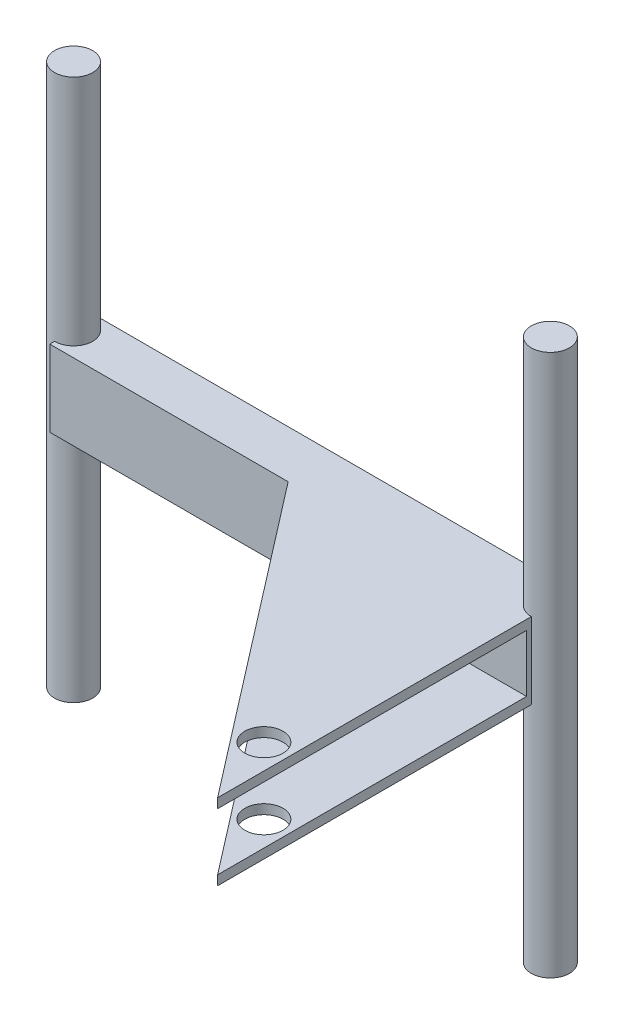
from build123d import *

# Parameters (mm, degrees)
SKETCH1_W                = 500
SKETCH1_H                = 80
BOSS_EXTRUDE1_DEPTH      = 50
BOSS_EXTRUDE2_DEPTH      = 244.1
BOSS_EXTRUDE2_DEPTH_BACK = 324.1
SKETCH2_R                = 20
BOSS_EXTRUDE5_DEPTH      = 10
BOSS_EXTRUDE6_DEPTH      = 10
CUT_EXTRUDE4_DEPTH       = 613.808106347
CUT_EXTRUDE4_DEPTH_BACK  = 613.808106347
SKETCH7_R                = 20


with BuildPart() as part:
    # Sketch1 → Boss-Extrude1 (new body)
    with BuildSketch(Plane.XY):
        with Locations((91.40969163, 3.77753304)):
            Rectangle(SKETCH1_W, SKETCH1_H)
    extrude(amount=BOSS_EXTRUDE1_DEPTH)

    # Sketch2 → Boss-Extrude2 (add, two sides: drawn at the far end of the back side and taken through both)
    with BuildSketch(Plane(origin=(0, 43.77753304, 0), x_dir=(1, 0, 0), z_dir=(0, 1, 0)).offset(-BOSS_EXTRUDE2_DEPTH_BACK)):
        with Locations(Location((-158.59030837, -25, 0), (0, 0, 270))):
            Circle(SKETCH2_R)
        with Locations(Location((341.40969163, -25, 0), (0, 0, 270))):
            Circle(SKETCH2_R)
    extrude(amount=BOSS_EXTRUDE2_DEPTH + BOSS_EXTRUDE2_DEPTH_BACK)

    # Sketch5 → Boss-Extrude5 (add)
    with BuildSketch(Plane(origin=(0, -36.22246696, 0), x_dir=(-1, 0, 0), z_dir=(0, -1, 0))):
        Polygon((-341.40969163, -50), (-341.40969163, -374), (-91.40969163, -50), align=None)
    extrude(amount=-BOSS_EXTRUDE5_DEPTH)

    # Sketch6 → Boss-Extrude6 (add)
    with BuildSketch(Plane(origin=(0, 43.77753304, 0), x_dir=(1, 0, 0), z_dir=(0, 1, 0))):
        Polygon((341.40969163, -50), (91.40969163, -50), (341.40969163, -374), align=None)
    extrude(amount=-BOSS_EXTRUDE6_DEPTH)

    # Sketch7 → Cut-Extrude4 (cut, two sides: drawn at the far end of the back side and taken through both)
    with BuildSketch(Plane(origin=(0, -36.22246696, 0), x_dir=(-1, 0, 0), z_dir=(0, -1, 0)).offset(-CUT_EXTRUDE4_DEPTH_BACK)):
        with Locations(Location((-315.24921844, -299.249641509, 0), (0, 0, 90))):
            Circle(SKETCH7_R)
    extrude(amount=CUT_EXTRUDE4_DEPTH + CUT_EXTRUDE4_DEPTH_BACK, mode=Mode.SUBTRACT)


solid = part.part
